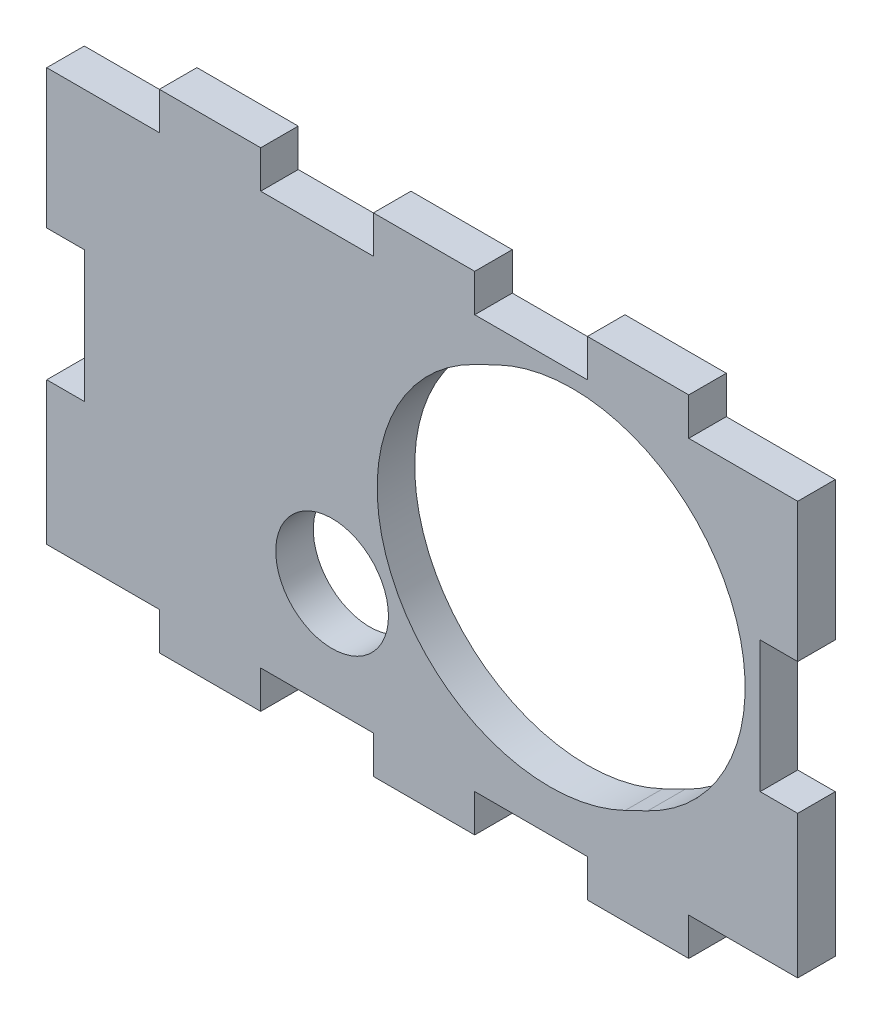
from build123d import *

# Parameters (mm, degrees)
ESQUISSE1_W             = 100
ESQUISSE1_H             = 65
BOSS_EXTRU_1_DEPTH      = 5
ESQUISSE2_W             = 15
ESQUISSE2_H             = 5.01
ESQUISSE2_W_2           = 15.01
ESQUISSE2_W_3           = 14.51
ESQUISSE2_W_4           = 5
ESQUISSE2_H_2           = 17.5
ENL_V_MAT_EXTRU_1_DEPTH = 5
ESQUISSE3_R             = 7.505
ENL_V_MAT_EXTRU_2_DEPTH = 10


with BuildPart() as part:
    # Esquisse1 → Boss.-Extru.1 (new body)
    with BuildSketch(Plane.XY):
        Rectangle(ESQUISSE1_W, ESQUISSE1_H)
    extrude(amount=BOSS_EXTRU_1_DEPTH)

    # Esquisse2 → Enlèv. mat.-Extru.1 (cut)
    with BuildSketch(Plane.XY.offset(5)):
        with Locations((-42.5, 29.995)):
            Rectangle(ESQUISSE2_W, ESQUISSE2_H)
        with Locations((-14.005, 29.995)):
            Rectangle(ESQUISSE2_W_2, ESQUISSE2_H)
        with Locations((14.495, 29.995)):
            Rectangle(ESQUISSE2_W_2, ESQUISSE2_H)
        with Locations((42.745, 29.995)):
            Rectangle(ESQUISSE2_W_3, ESQUISSE2_H)
        with Locations((-47.5, 0.25)):
            Rectangle(ESQUISSE2_W_4, ESQUISSE2_H_2)
        with Locations((47.5, 0.25)):
            Rectangle(ESQUISSE2_W_4, ESQUISSE2_H_2)
        with Locations((42.745, -29.995)):
            Rectangle(ESQUISSE2_W_3, ESQUISSE2_H)
        with Locations((14.495, -29.995)):
            Rectangle(ESQUISSE2_W_2, ESQUISSE2_H)
        with Locations((-14.005, -29.995)):
            Rectangle(ESQUISSE2_W_2, ESQUISSE2_H)
        with Locations((-42.5, -29.995)):
            Rectangle(ESQUISSE2_W, ESQUISSE2_H)
    extrude(amount=-ENL_V_MAT_EXTRU_1_DEPTH, mode=Mode.SUBTRACT)

    # Esquisse3 → Enlèv. mat.-Extru.2 (cut)
    with BuildSketch(Plane.XY.offset(5)):
        with Locations((-12, -13)):
            Circle(ESQUISSE3_R)
        with BuildLine():
            Line((6.973645564, 21.746445448), (9.973645564, 23.199570448))
            ThreePointArc((9.973645564, 23.199570448), (40.699570448, 12.526354436), (30.026354436, -18.199570448))
            Line((30.026354436, -18.199570448), (27.026354436, -19.652695448))
            ThreePointArc((27.026354436, -19.652695448), (-3.699570448, -8.979479436), (6.973645564, 21.746445448))
        make_face()
    extrude(amount=-ENL_V_MAT_EXTRU_2_DEPTH, mode=Mode.SUBTRACT)


solid = part.part
